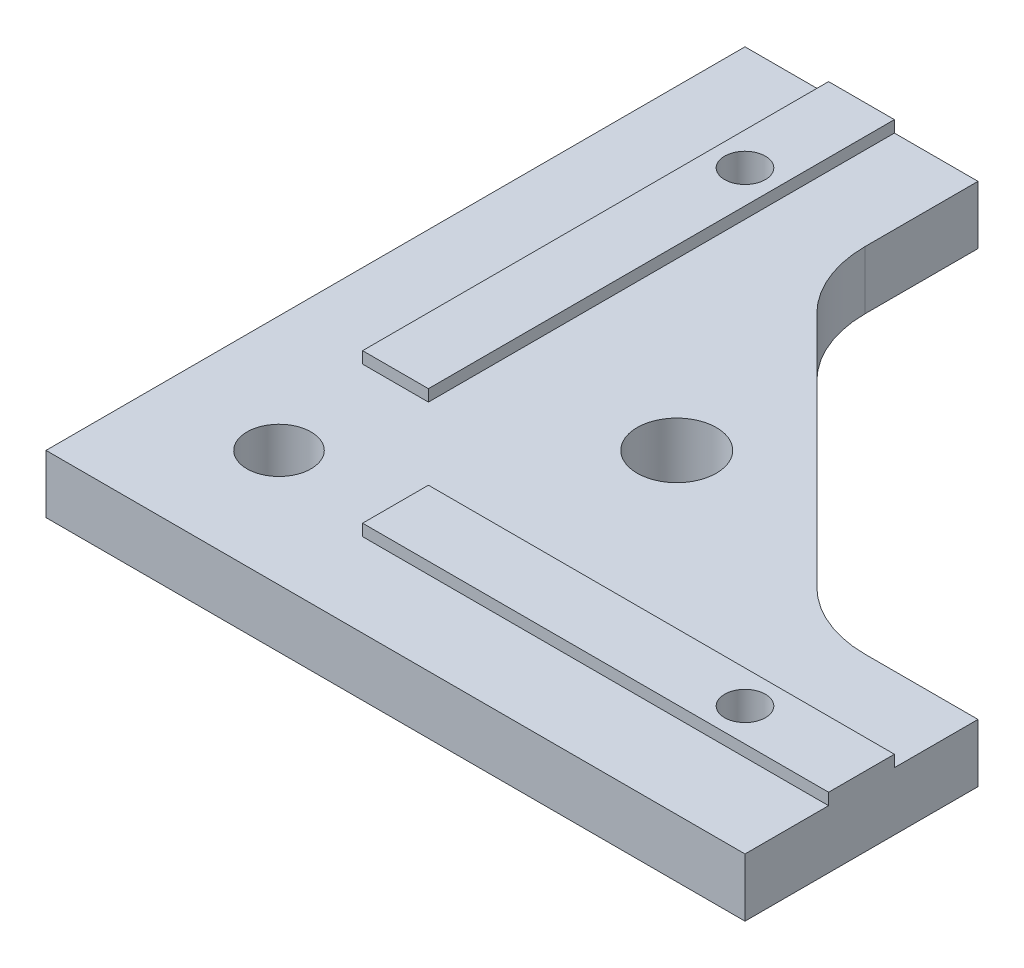
from build123d import *

# Parameters (mm, degrees)
ESBO_O1_R                = 2.75
ESBO_O1_R_2              = 1.75
RESSALTO_EXTRUS_O1_DEPTH = 5
ESBO_O2_W                = 40
ESBO_O2_H                = 5.65
ESBO_O2_R                = 1.75
ESBO_O2_W_2              = 5.65
ESBO_O2_H_2              = 40
RESSALTO_EXTRUS_O2_DEPTH = 1
RESSALTO_EXTRUS_O3_DEPTH = 5
FILETE1_R                = 10


with BuildPart() as part:
    # Esboço1 → Ressalto-extrusão1 (new body)
    with BuildSketch(Plane(origin=(0, 0, 0), x_dir=(1, 0, 0), z_dir=(0, 1, 0))):
        Polygon((52.928932188, 20), (60, 20), (60, 0), (0, 0), (0, 60), (20, 60), (20, 52.928932188), (20, 20), align=None)
        with Locations(Location((10, 10, 0), (0, 0, 270))):
            Circle(ESBO_O1_R, mode=Mode.SUBTRACT)
        with Locations(Location((50, 10, 0), (0, 0, 270))):
            Circle(ESBO_O1_R_2, mode=Mode.SUBTRACT)
        with Locations(Location((10, 50, 0), (0, 0, 270))):
            Circle(ESBO_O1_R_2, mode=Mode.SUBTRACT)
    extrude(amount=RESSALTO_EXTRUS_O1_DEPTH)

    # Esboço2 → Ressalto-extrusão2 (add)
    # profile 1 of 2: a face of its own
    with BuildSketch(Plane(origin=(0, 5, 0), x_dir=(1, 0, 0), z_dir=(0, 1, 0))):
        with Locations((40, 10)):
            Rectangle(ESBO_O2_W, ESBO_O2_H)
        with Locations((50, 10)):
            Circle(ESBO_O2_R, mode=Mode.SUBTRACT)
    # profile 2 of 2: a face of its own
    with BuildSketch(Plane(origin=(0, 5, 0), x_dir=(1, 0, 0), z_dir=(0, 1, 0))):
        with Locations((10, 40)):
            Rectangle(ESBO_O2_W_2, ESBO_O2_H_2)
        with Locations((10, 50)):
            Circle(ESBO_O2_R, mode=Mode.SUBTRACT)
    extrude(amount=RESSALTO_EXTRUS_O2_DEPTH)

    # Esboço3 → Ressalto-extrusão3 (add)
    with BuildSketch(Plane.XZ):
        with BuildLine():
            Line((24.666904756, -24.666904756), (20, -20))
            Line((20, -20), (20, -46.162950904))
            Line((20, -46.162950904), (33.081475452, -33.081475452))
            Line((33.081475452, -33.081475452), (29.475230868, -29.475230868))
            ThreePointArc((29.475230868, -29.475230868), (24.666904756, -29.475230868), (24.666904756, -24.666904756))
        make_face()
        with BuildLine():
            Line((46.162950904, -20), (20, -20))
            Line((20, -20), (24.666904756, -24.666904756))
            ThreePointArc((24.666904756, -24.666904756), (28.372191482, -23.929877401), (30.471067812, -27.071067812))
            ThreePointArc((30.471067812, -27.071067812), (30.212258222, -28.372191482), (29.475230868, -29.475230868))
            Line((29.475230868, -29.475230868), (33.081475452, -33.081475452))
            Line((33.081475452, -33.081475452), (46.162950904, -20))
        make_face()
    extrude(amount=-RESSALTO_EXTRUS_O3_DEPTH)

    # Filete1
    filete1_edges = [part.edges().sort_by_distance(p)[0] for p in [
        (46.162950904, 2.5, -20),
        (20, 2.5, -46.162950904),
    ]]
    fillet(filete1_edges, radius=FILETE1_R)


solid = part.part
